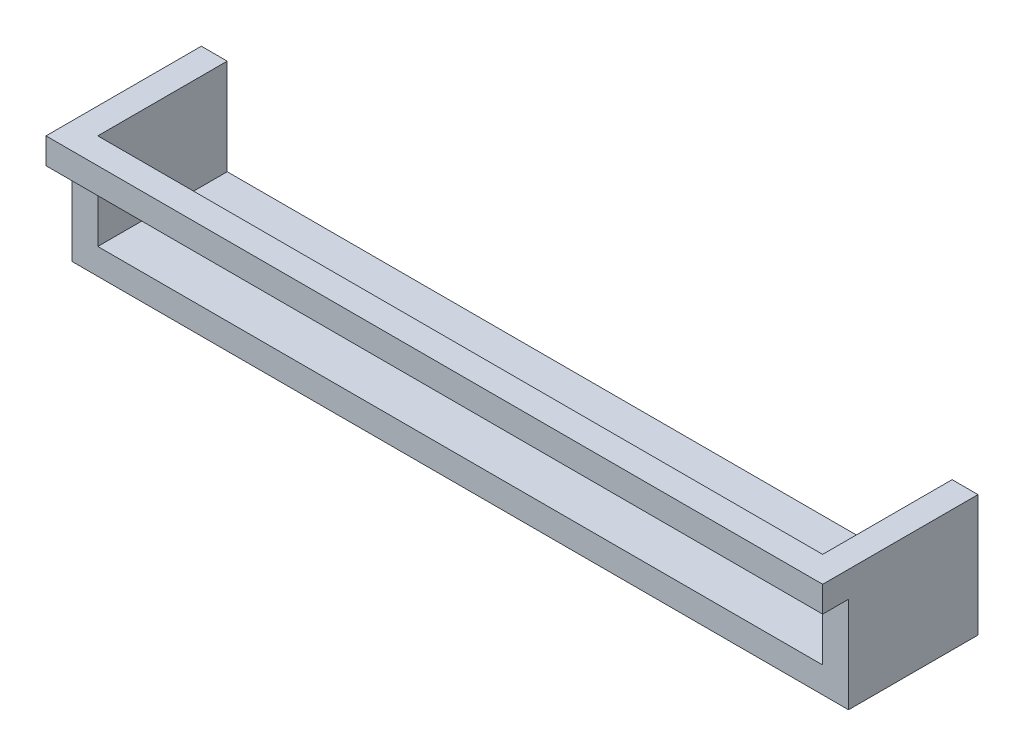
from build123d import *

# Parameters (mm, degrees)
SKETCH_1_W           = 600
SKETCH_1_H           = 100
EXTRUDE_1_DEPTH      = 20
SKETCH_2_W           = 20
SKETCH_2_H           = 100
EXTRUDE_2_DEPTH      = 74
EXTRUDE_3_DEPTH      = 300
EXTRUDE_3_DEPTH_BACK = 300
SKETCH_3_W           = 20
SKETCH_3_H           = 20


with BuildPart() as part:
    # Эскиз1 → Выдавливание1 (new body)
    with BuildSketch(Plane(origin=(0, 0, 0), x_dir=(-1, 0, 0), z_dir=(0, 1, 0))):
        Rectangle(SKETCH_1_W, SKETCH_1_H)
    extrude(amount=EXTRUDE_1_DEPTH)

    # Эскиз2 → Выдавливание2 (add)
    with BuildSketch(Plane(origin=(0, 20, 0), x_dir=(-1, 0, 0), z_dir=(0, 1, 0))):
        with Locations((-290, 0)):
            Rectangle(SKETCH_2_W, SKETCH_2_H)
        with Locations((290, 0)):
            Rectangle(SKETCH_2_W, SKETCH_2_H)
    extrude(amount=EXTRUDE_2_DEPTH)

    # Эскиз3 → Выдавливание3 (add, two sides: drawn at the far end of the back side and taken through both)
    with BuildSketch(Plane.YZ.offset(-EXTRUDE_3_DEPTH_BACK)):
        with Locations((84, 60)):
            Rectangle(SKETCH_3_W, SKETCH_3_H)
    extrude(amount=EXTRUDE_3_DEPTH + EXTRUDE_3_DEPTH_BACK)


solid = part.part
